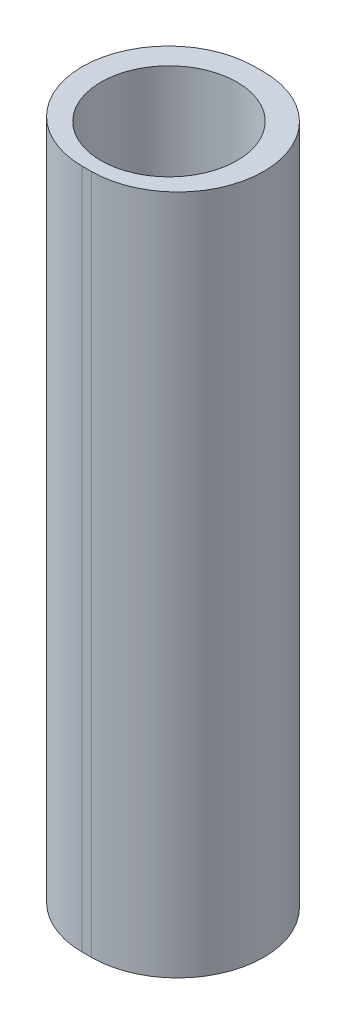
from build123d import *

# Parameters (mm, degrees)
SKETCH1_W                   = 3.8
SKETCH1_H                   = 15
BOSS_EXTRUDE1_DEPTH         = 2
FILLET1_RADIUS              = 1.9
FILLET1_LENGTH              = 15
FILLET1_OF_MIRROR1_2_RADIUS = 1.9
FILLET1_OF_MIRROR1_2_LENGTH = 15
SKETCH3_R                   = 1.5
CUT_EXTRUDE1_DEPTH          = 15


with BuildPart() as part:
    # Sketch1 → Boss-Extrude1 (new body)
    with BuildSketch(Plane(origin=(0, 0, 0), x_dir=(0, 0, -1), z_dir=(1, 0, 0))):
        with Locations((1.9, 7.5)):
            Rectangle(SKETCH1_W, SKETCH1_H)
    boss_extrude1 = extrude(amount=BOSS_EXTRUDE1_DEPTH)

    # Fillet1: full round fillet: the end face becomes a half cylinder, R = half its width
    fillet1_face = Plane((2, 7.5, -1.9), x_dir=(0, 1, 0), z_dir=(1, 0, 0))  # on the end face: x along it, z out of the body
    fillet1_slab = fillet1_face.offset(-FILLET1_RADIUS / 2) * Box(FILLET1_LENGTH, 2 * FILLET1_RADIUS, FILLET1_RADIUS, mode=Mode.PRIVATE)  # the body's end, R deep
    fillet1_round = Plane((0.1, 7.5, -1.9), x_dir=(1, 0, 0), z_dir=(0, 1, 0)) * Cylinder(FILLET1_RADIUS, FILLET1_LENGTH, mode=Mode.PRIVATE)  # its axis R under the face
    add(fillet1_slab - fillet1_round, mode=Mode.SUBTRACT)

    # Mirror1: Boss-Extrude1 across plane
    add(boss_extrude1.mirror(Plane.ZY))

    # Fillet1 of Mirror1 2: full round fillet: the end face becomes a half cylinder, R = half its width
    fillet1_of_mirror1_2_face = Plane((-2, 7.5, -1.9), x_dir=(0, 1, 0), z_dir=(-1, 0, 0))  # on the end face: x along it, z out of the body
    fillet1_of_mirror1_2_slab = fillet1_of_mirror1_2_face.offset(-FILLET1_OF_MIRROR1_2_RADIUS / 2) * Box(FILLET1_OF_MIRROR1_2_LENGTH, 2 * FILLET1_OF_MIRROR1_2_RADIUS, FILLET1_OF_MIRROR1_2_RADIUS, mode=Mode.PRIVATE)  # the body's end, R deep
    fillet1_of_mirror1_2_round = Plane((-0.1, 7.5, -1.9), x_dir=(-1, 0, 0), z_dir=(0, 1, 0)) * Cylinder(FILLET1_OF_MIRROR1_2_RADIUS, FILLET1_OF_MIRROR1_2_LENGTH, mode=Mode.PRIVATE)  # its axis R under the face
    add(fillet1_of_mirror1_2_slab - fillet1_of_mirror1_2_round, mode=Mode.SUBTRACT)

    # Sketch3 → Cut-Extrude1 (cut)
    with BuildSketch(Plane.XZ):
        with Locations(Location((0, -1.811318553, 0), (0, 0, 270))):
            Circle(SKETCH3_R)
    extrude(amount=-CUT_EXTRUDE1_DEPTH, mode=Mode.SUBTRACT)


solid = part.part
